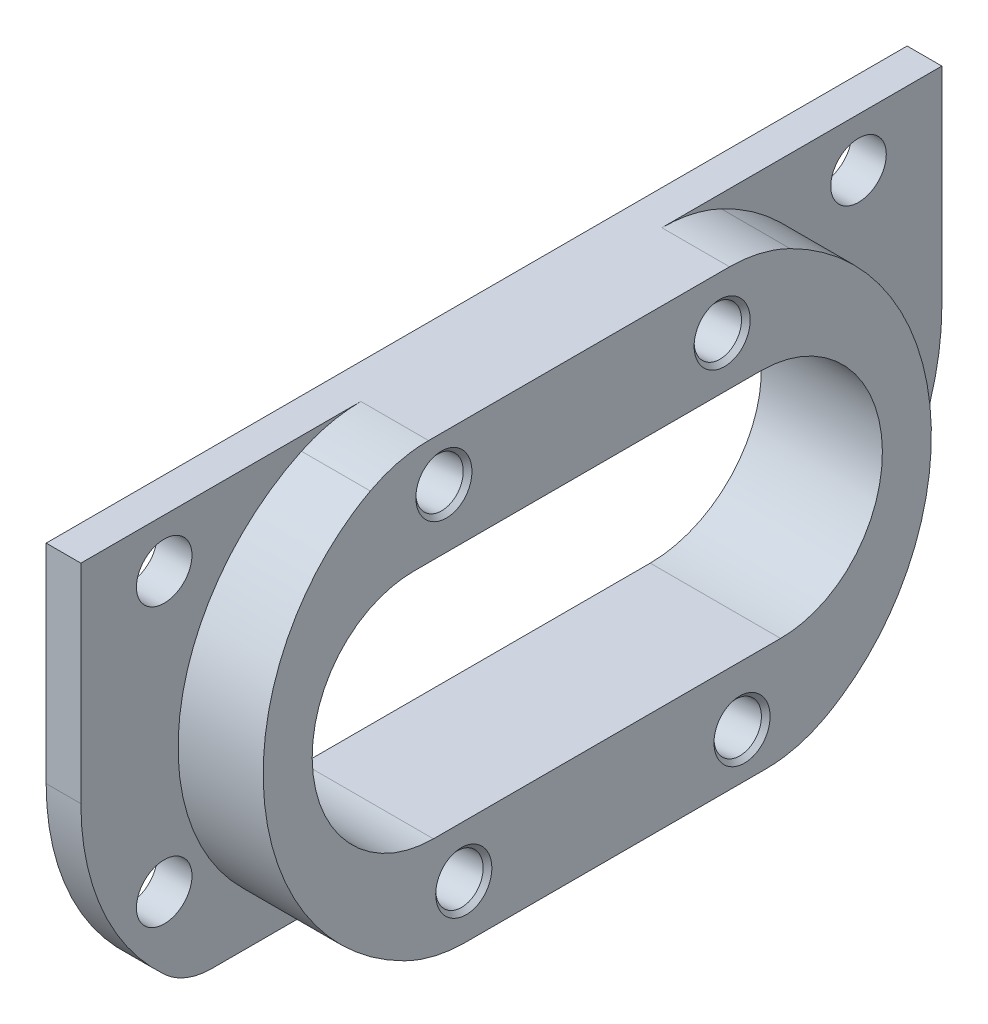
from build123d import *

# Parameters (mm, degrees)
SZKIC1_R                                   = 4
DODANIE_WYCI_GNI_CIE1_DEPTH                = 20
SZKIC2_OUTSIDE_W                           = 153.84
SZKIC2_OUTSIDE_H                           = 89.84
WYTNIJ_WYCI_GNI_CIE1_DEPTH                 = 15
WYTNIJ_WYCI_GNI_CIE2_DEPTH                 = 130.135587659
WYTNIJ_WYCI_GNI_CIE2_DEPTH_BACK            = 130.135587659
OTW_R_GWINTOWANY_M81_D                     = 6.8
OTW_R_GWINTOWANY_M81_DEPTH                 = 12.957073895
OTW_R_GWINTOWANY_M81_CSINK_D               = 8.05
OTW_R_GWINTOWANY_M81_CSINK_ANGLE           = 90
OTW_R_GWINTOWANY_M81_TIP                   = 2.042926105
OTW_R_GWINTOWANY_M81_ON_FACE_2_D           = 6.8
OTW_R_GWINTOWANY_M81_ON_FACE_2_DEPTH       = 12.957073895
OTW_R_GWINTOWANY_M81_ON_FACE_2_CSINK_D     = 8.05
OTW_R_GWINTOWANY_M81_ON_FACE_2_CSINK_ANGLE = 90
OTW_R_GWINTOWANY_M81_ON_FACE_2_TIP         = 2.042926105
OTW_R_GWINTOWANY_M81_ON_FACE_3_D           = 6.8
OTW_R_GWINTOWANY_M81_ON_FACE_3_DEPTH       = 12.957073895
OTW_R_GWINTOWANY_M81_ON_FACE_3_CSINK_D     = 8.05
OTW_R_GWINTOWANY_M81_ON_FACE_3_CSINK_ANGLE = 90
OTW_R_GWINTOWANY_M81_ON_FACE_3_TIP         = 2.042926105


with BuildPart() as part:
    # Szkic1 → Dodanie-wyciągnięcie1 (new body)
    with BuildSketch(Plane(origin=(0, 0, 0), x_dir=(0, 0, -1), z_dir=(1, 0, 0))):
        with BuildLine():
            Line((-43.138357147, -30), (43.138357147, -30))
            ThreePointArc((43.138357147, -30), (46.738768646, -29.329364235), (49.856267202, -27.407407407))
            ThreePointArc((49.856267202, -27.407407407), (58.828108774, -14.988630917), (62, 0))
            Line((62, 0), (62, 30))
            Line((62, 30), (-62, 30))
            Line((-62, 30), (-62, 0))
            ThreePointArc((-62, 0), (-58.828108774, -14.988630917), (-49.856267202, -27.407407407))
            ThreePointArc((-49.856267202, -27.407407407), (-46.738768646, -29.329364235), (-43.138357147, -30))
        make_face()
        with Locations((-50, 23)):
            Circle(SZKIC1_R, mode=Mode.SUBTRACT)
        with Locations((50, 23)):
            Circle(SZKIC1_R, mode=Mode.SUBTRACT)
        with Locations((50, -17)):
            Circle(SZKIC1_R, mode=Mode.SUBTRACT)
        with Locations((-50, -17)):
            Circle(SZKIC1_R, mode=Mode.SUBTRACT)
        with BuildLine():
            Line((-25, -16), (25, -16))
            ThreePointArc((25, -16), (41, 0), (25, 16))
            Line((25, 16), (-25, 16))
            ThreePointArc((-25, 16), (-41, 0), (-25, -16))
        make_face(mode=Mode.SUBTRACT)
    extrude(amount=DODANIE_WYCI_GNI_CIE1_DEPTH)

    # Szkic2 outside → Wytnij-wyciągnięcie1 (cut)
    # profile 1 of 2: a face of its own
    with BuildSketch(Plane(origin=(20, 0, 0), x_dir=(0, 0, -1), z_dir=(1, 0, 0))):
        Rectangle(SZKIC2_OUTSIDE_W, SZKIC2_OUTSIDE_H)
        with BuildLine():
            Line((21.671768561, 30), (-21.671768561, 30))
            ThreePointArc((-21.671768561, 30), (-26.059642547, 29.512728202), (-30.233707808, 28.074656189))
            ThreePointArc((-30.233707808, 28.074656189), (-48, 0), (-30.233707808, -28.074656189))
            ThreePointArc((-30.233707808, -28.074656189), (-26.059642547, -29.512728202), (-21.671768561, -30))
            Line((-21.671768561, -30), (21.671768561, -30))
            ThreePointArc((21.671768561, -30), (26.059642547, -29.512728202), (30.233707808, -28.074656189))
            ThreePointArc((30.233707808, -28.074656189), (48, 0), (30.233707808, 28.074656189))
            ThreePointArc((30.233707808, 28.074656189), (26.059642547, 29.512728202), (21.671768561, 30))
        make_face(mode=Mode.SUBTRACT)
    # profile 2 of 2: a face of its own
    with BuildSketch(Plane(origin=(20, 0, 0), x_dir=(0, 0, -1), z_dir=(1, 0, 0))):
        with BuildLine():
            Line((-25, -16), (25, -16))
            ThreePointArc((25, -16), (41, 0), (25, 16))
            Line((25, 16), (-25, 16))
            ThreePointArc((-25, 16), (-41, 0), (-25, -16))
        make_face()
    extrude(amount=-WYTNIJ_WYCI_GNI_CIE1_DEPTH, mode=Mode.SUBTRACT)

    # Szkic3 → Wytnij-wyciągnięcie2 (cut, two sides: drawn at the far end of the back side and taken through both)
    with BuildSketch(Plane(origin=(0, 0, -62), x_dir=(-1, 0, 0), z_dir=(0, 0, -1)).offset(-WYTNIJ_WYCI_GNI_CIE2_DEPTH_BACK)):
        Polygon((-14.750680188, 30), (-20, 30), (-20, -30), align=None)
    extrude(amount=WYTNIJ_WYCI_GNI_CIE2_DEPTH + WYTNIJ_WYCI_GNI_CIE2_DEPTH_BACK, mode=Mode.SUBTRACT)

    # Otwór gwintowany M81
    with Locations(Plane(origin=(15.280832977, 23.940325899, 20), x_dir=(-0.087155742748, 0.996194698092, 0), z_dir=(0.996194698092, 0.087155742748, 0))):
        with Locations((0, 0), (-46.983894274, 1.23031657)):
            CounterSinkHole(OTW_R_GWINTOWANY_M81_D / 2, OTW_R_GWINTOWANY_M81_CSINK_D / 2, depth=OTW_R_GWINTOWANY_M81_DEPTH, counter_sink_angle=OTW_R_GWINTOWANY_M81_CSINK_ANGLE)
            with Locations((0, 0, -(OTW_R_GWINTOWANY_M81_DEPTH + OTW_R_GWINTOWANY_M81_TIP / 2))):  # 118° drill point
                Cone(0, OTW_R_GWINTOWANY_M81_D / 2, OTW_R_GWINTOWANY_M81_TIP, mode=Mode.SUBTRACT)

    # Otwór gwintowany M81 on face 2
    with Locations(Plane(origin=(15.372091832, 22.897232415, -19.986292999), x_dir=(-0.087155971833, 0.996194678049, 0), z_dir=(0.996194678049, 0.087155971833, 0))):
        with Locations((0, 0)):
            CounterSinkHole(OTW_R_GWINTOWANY_M81_ON_FACE_2_D / 2, OTW_R_GWINTOWANY_M81_ON_FACE_2_CSINK_D / 2, depth=OTW_R_GWINTOWANY_M81_ON_FACE_2_DEPTH, counter_sink_angle=OTW_R_GWINTOWANY_M81_ON_FACE_2_CSINK_ANGLE)
            with Locations((0, 0, -(OTW_R_GWINTOWANY_M81_ON_FACE_2_DEPTH + OTW_R_GWINTOWANY_M81_ON_FACE_2_TIP / 2))):  # 118° drill point
                Cone(0, OTW_R_GWINTOWANY_M81_ON_FACE_2_D / 2, OTW_R_GWINTOWANY_M81_ON_FACE_2_TIP, mode=Mode.SUBTRACT)

    # Otwór gwintowany M81 on face 3
    with Locations(Plane(origin=(19.467008034, -23.907873957, -18.755976429), x_dir=(-0.087155971833, 0.996194678049, 0), z_dir=(0.996194678049, 0.087155971833, 0))):
        with Locations((0, 0)):
            CounterSinkHole(OTW_R_GWINTOWANY_M81_ON_FACE_3_D / 2, OTW_R_GWINTOWANY_M81_ON_FACE_3_CSINK_D / 2, depth=OTW_R_GWINTOWANY_M81_ON_FACE_3_DEPTH, counter_sink_angle=OTW_R_GWINTOWANY_M81_ON_FACE_3_CSINK_ANGLE)
            with Locations((0, 0, -(OTW_R_GWINTOWANY_M81_ON_FACE_3_DEPTH + OTW_R_GWINTOWANY_M81_ON_FACE_3_TIP / 2))):  # 118° drill point
                Cone(0, OTW_R_GWINTOWANY_M81_ON_FACE_3_D / 2, OTW_R_GWINTOWANY_M81_ON_FACE_3_TIP, mode=Mode.SUBTRACT)


solid = part.part
